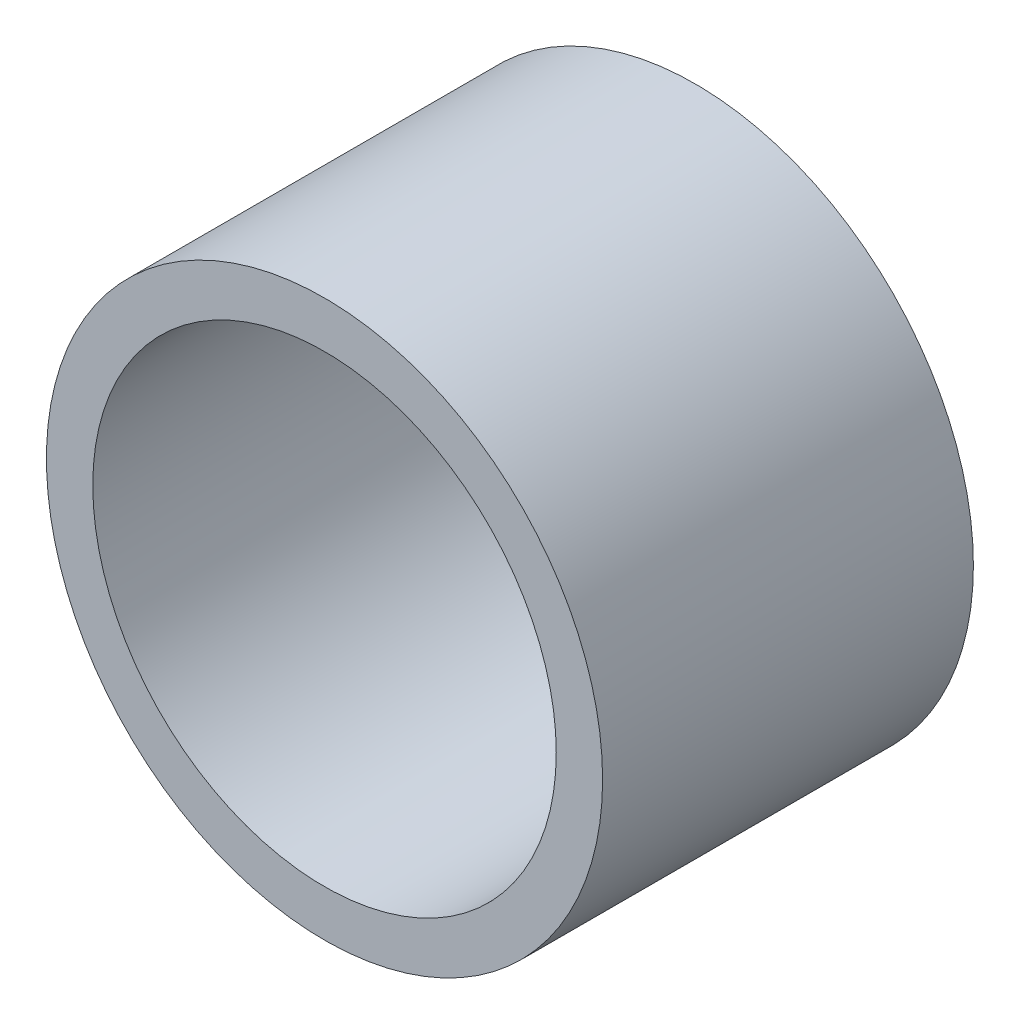
from build123d import *

# Parameters (mm, degrees)
ESQUISSE1_R        = 6
ESQUISSE1_R_2      = 5
BOSS_EXTRU_1_DEPTH = 8


with BuildPart() as part:
    # Esquisse1 → Boss.-Extru.1 (new body)
    with BuildSketch(Plane.XY):
        Circle(ESQUISSE1_R)
        Circle(ESQUISSE1_R_2, mode=Mode.SUBTRACT)
    extrude(amount=BOSS_EXTRU_1_DEPTH)


solid = part.part
